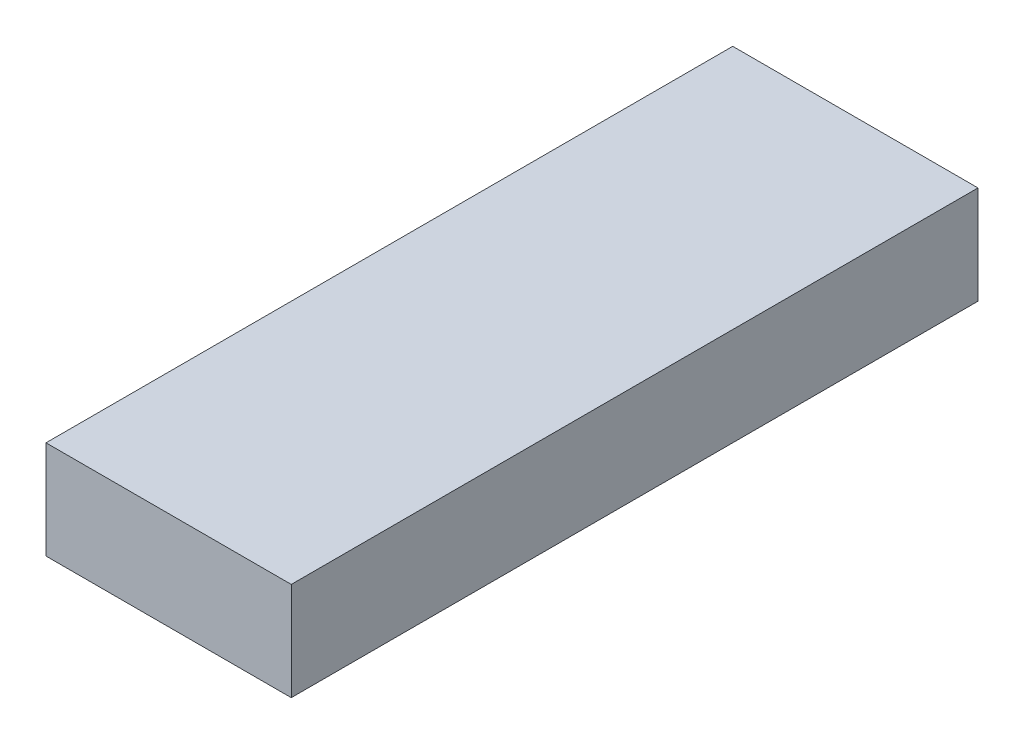
from build123d import *

# Parameters (mm, degrees)
SKETCH1_W           = 25
SKETCH1_H           = 70
BOSS_EXTRUDE1_DEPTH = 10


with BuildPart() as part:
    # Sketch1 → Boss-Extrude1 (new body)
    with BuildSketch(Plane(origin=(0, 0, 0), x_dir=(1, 0, 0), z_dir=(0, 1, 0))):
        Rectangle(SKETCH1_W, SKETCH1_H)
    extrude(amount=BOSS_EXTRUDE1_DEPTH)


solid = part.part
